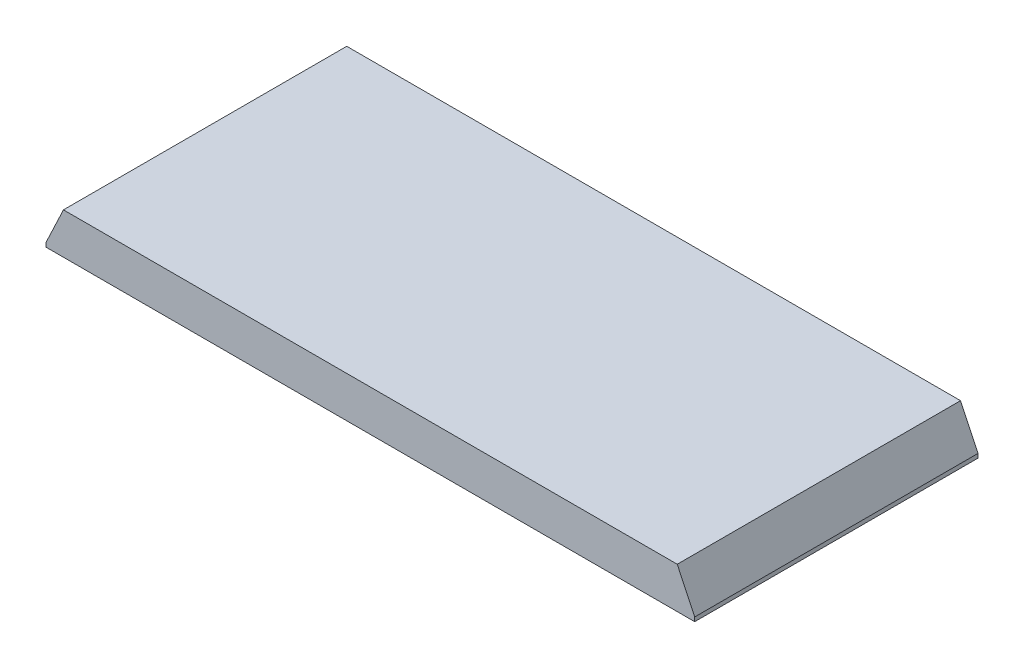
from build123d import *

# Parameters (mm, degrees)
EXTRUDE_1_DEPTH = 69


with BuildPart() as part:
    # 草图1 → 凸台-拉伸1 (new body)
    with BuildSketch(Plane.XY):
        Polygon((74.75, 0), (-74.75, 0), (-79, -9), (-79, -10), (79, -10), (79, -9), align=None)
    extrude(amount=EXTRUDE_1_DEPTH)


solid = part.part
